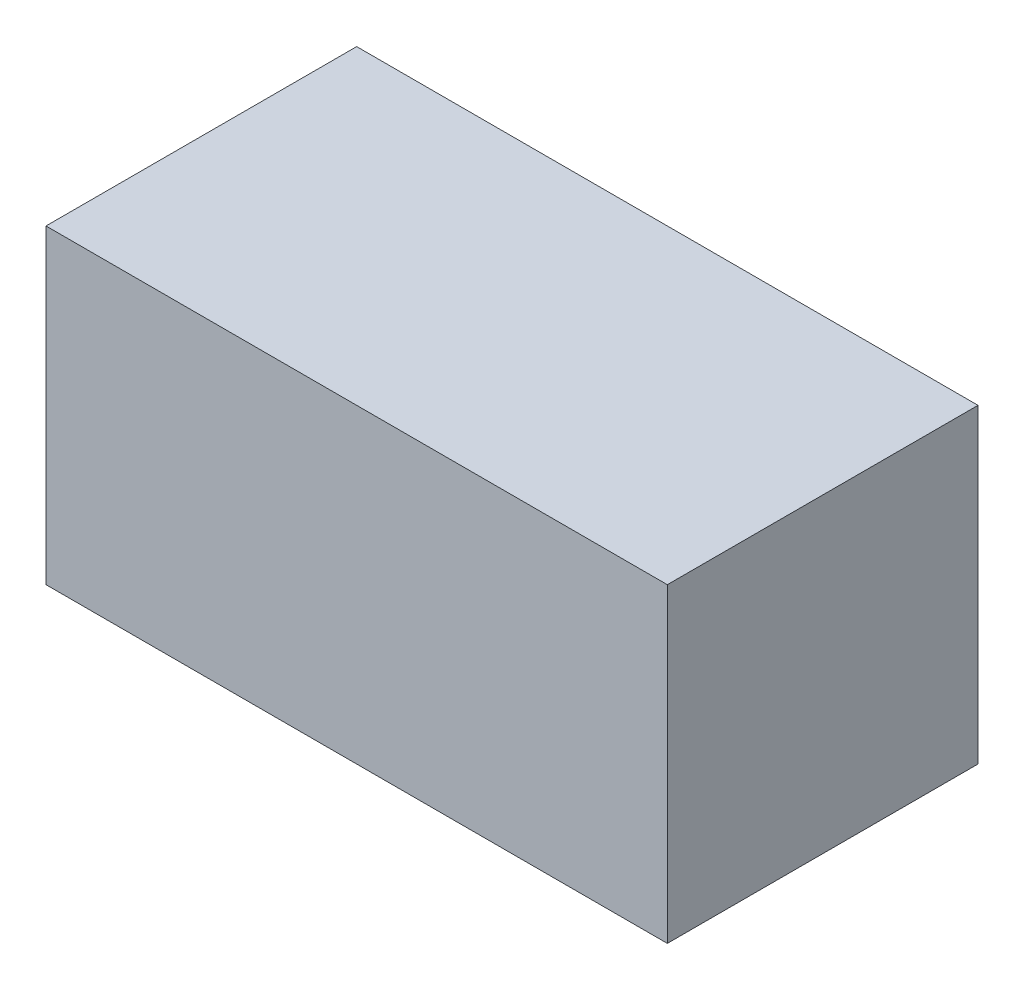
from build123d import *

# Parameters (mm, degrees)
SKETCH1_W           = 1000
SKETCH1_H           = 1000
BOSS_EXTRUDE1_DEPTH = 2000


with BuildPart() as part:
    # Sketch1 → Boss-Extrude1 (new body)
    with BuildSketch(Plane.YZ):
        with Locations((500, -500)):
            Rectangle(SKETCH1_W, SKETCH1_H)
    extrude(amount=BOSS_EXTRUDE1_DEPTH)


solid = part.part
